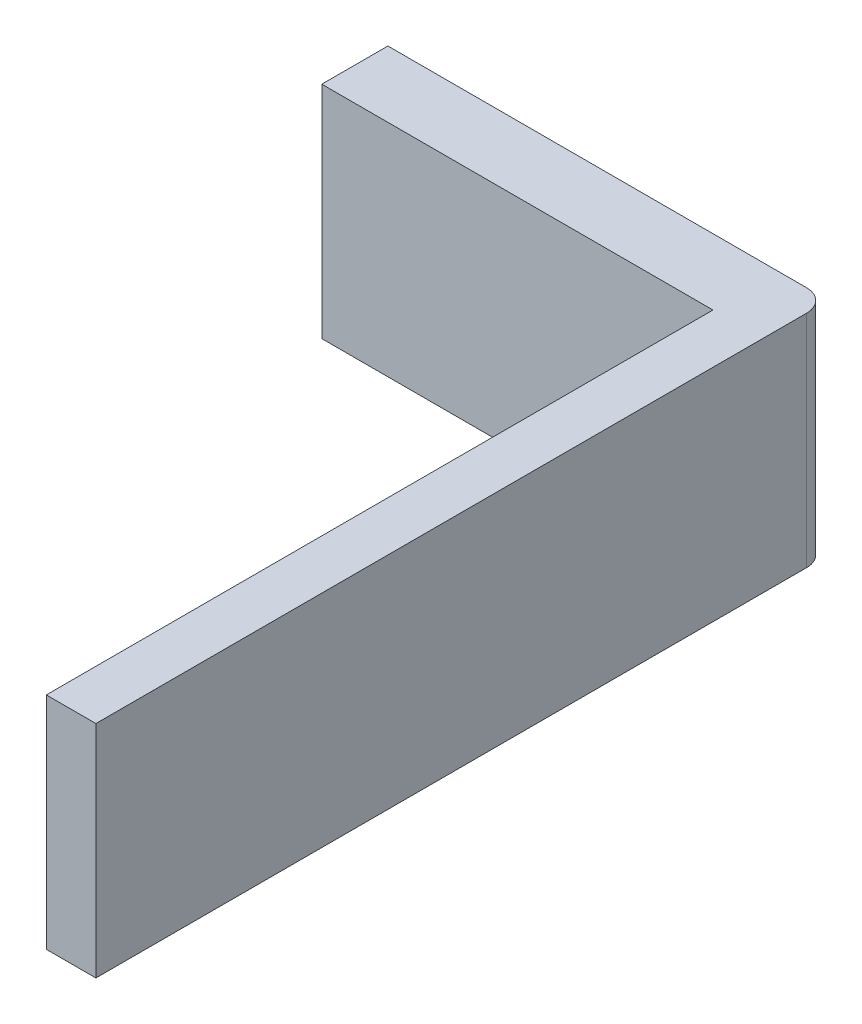
from build123d import *

# Parameters (mm, degrees)
EXTRUDE_THIN1_DEPTH = 20
SKETCH2_W           = 40
SKETCH2_H           = 20
BOSS_EXTRUDE1_DEPTH = 1.5
FILLET1_R           = 2


with BuildPart() as part:
    # Sketch1 → Extrude-Thin1 (new body)
    with BuildSketch(Plane(origin=(0, 0, 0), x_dir=(1, 0, 0), z_dir=(0, 1, 0))):
        Polygon((0, -65), (0, 0), (-40, 0), (-40, -4.5), (-4.5, -4.5), (-4.5, -65), align=None)
    extrude(amount=EXTRUDE_THIN1_DEPTH)

    # Sketch2 → Boss-Extrude1 (add)
    with BuildSketch(Plane(origin=(0, 0, 0), x_dir=(-1, 0, 0), z_dir=(0, 0, -1))):
        with Locations((20, 10)):
            Rectangle(SKETCH2_W, SKETCH2_H)
    extrude(amount=BOSS_EXTRUDE1_DEPTH)

    # Fillet1
    fillet1_edges = [part.edges().sort_by_distance(p)[0] for p in [
        (0, 10, -1.5),
    ]]
    fillet(fillet1_edges, radius=FILLET1_R)


solid = part.part
